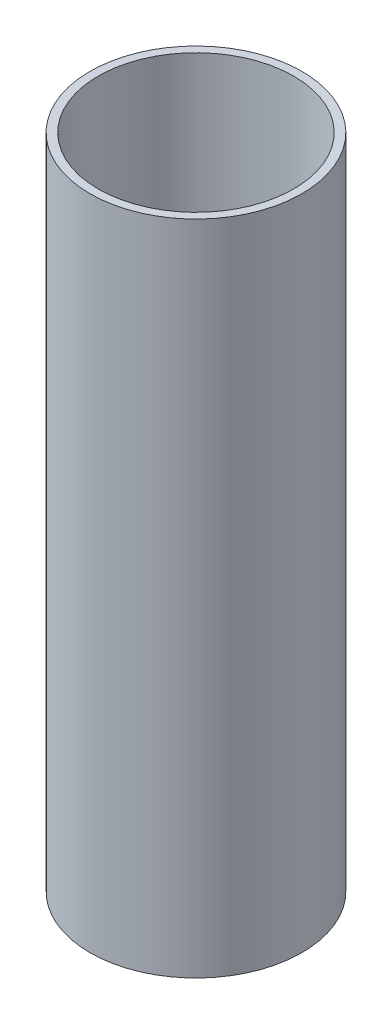
from build123d import *

# Parameters (mm, degrees)
SKETCH1_R           = 19.35
SKETCH1_R_2         = 17.85
BOSS_EXTRUDE1_DEPTH = 60


with BuildPart() as part:
    # Sketch1 → Boss-Extrude1 (new, symmetric)
    with BuildSketch(Plane(origin=(0, 0, 0), x_dir=(1, 0, 0), z_dir=(0, 1, 0))):
        with Locations(Location((0, 0, 0), (0, 0, 270))):
            Circle(SKETCH1_R)
        with Locations(Location((0, 0, 0), (0, 0, 270))):
            Circle(SKETCH1_R_2, mode=Mode.SUBTRACT)
    extrude(amount=BOSS_EXTRUDE1_DEPTH, both=True)


solid = part.part
